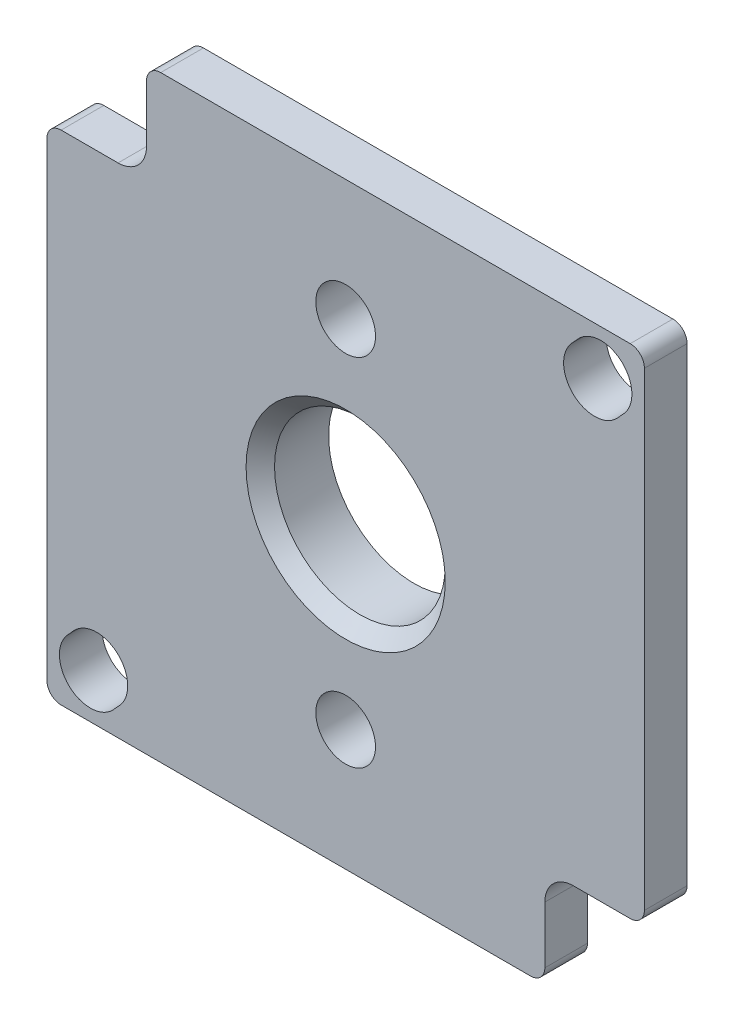
from build123d import *

# Parameters (mm, degrees)
SKETCH1_W                = 42
SKETCH1_H                = 42
BOSS_EXTRUDE1_DEPTH      = 3
SKETCH2_W                = 7
SKETCH2_H                = 7
CUT_EXTRUDE1_DEPTH       = 30.849623113
SKETCH3_W                = 7
SKETCH3_H                = 7
CUT_EXTRUDE2_DEPTH       = 30.849623113
CUT_EXTRUDE3_DEPTH       = 30.849623113
CUT_EXTRUDE4_DEPTH       = 30.849623113
BOSS_EXTRUDE2_DEPTH      = 1.8
CUT_EXTRUDE5_DEPTH       = 1.8
CUT_EXTRUDE6_DEPTH       = 1.8
CUT_EXTRUDE7_DEPTH       = 1.8
CUT_EXTRUDE8_DEPTH       = 1.8
CUT_EXTRUDE9_DEPTH       = 1.8
CUT_EXTRUDE10_DEPTH      = 1.8
F_6_CLEARANCE_HOLE1_D    = 4.2
F_7_16_CLEARANCE_HOLE1_D = 12
CHAMFER1_SIZE            = 1
CHAMFER2_SIZE            = 0.5
FILLET1_R                = 1
FILLET2_R                = 2


with BuildPart() as part:
    # Sketch1 → Boss-Extrude1 (new body)
    with BuildSketch(Plane(origin=(0, 0, -1.5), x_dir=(-1, 0, 0), z_dir=(0, 0, -1))):
        Rectangle(SKETCH1_W, SKETCH1_H)
    extrude(amount=-BOSS_EXTRUDE1_DEPTH)

    # Sketch2 → Cut-Extrude1 (cut, through all)
    with BuildSketch(Plane.XY.offset(1.5)):
        with Locations((17.5, -17.5)):
            Rectangle(SKETCH2_W, SKETCH2_H)
    extrude(amount=-CUT_EXTRUDE1_DEPTH, mode=Mode.SUBTRACT)

    # Sketch3 → Cut-Extrude2 (cut, through all)
    with BuildSketch(Plane.XY.offset(1.5)):
        with Locations((-17.5, 17.5)):
            Rectangle(SKETCH3_W, SKETCH3_H)
    extrude(amount=-CUT_EXTRUDE2_DEPTH, mode=Mode.SUBTRACT)

    # Sketch4 → Cut-Extrude3 (cut, through all)
    with BuildSketch(Plane(origin=(0, 0, -1.5), x_dir=(-1, 0, 0), z_dir=(0, 0, -1))):
        with BuildLine():
            Line((-19.548087821, 16.508696573), (-19.107888427, 16.027894431))
            ThreePointArc((-19.107888427, 16.027894431), (-16.027894431, 15.892111573), (-15.892111573, 18.972105569))
            Line((-15.892111573, 18.972105569), (-16.332310968, 19.452907712))
            ThreePointArc((-16.332310968, 19.452907712), (-19.412304964, 19.588690569), (-19.548087821, 16.508696573))
        make_face()
    extrude(amount=-CUT_EXTRUDE3_DEPTH, mode=Mode.SUBTRACT)

    # Sketch5 → Cut-Extrude4 (cut, through all)
    with BuildSketch(Plane.XY.offset(1.5)):
        with BuildLine():
            Line((-16.332310968, -19.452907712), (-15.892111573, -18.972105569))
            ThreePointArc((-15.892111573, -18.972105569), (-16.027894431, -15.892111573), (-19.107888427, -16.027894431))
            Line((-19.107888427, -16.027894431), (-19.548087821, -16.508696573))
            ThreePointArc((-19.548087821, -16.508696573), (-19.412304964, -19.588690569), (-16.332310968, -19.452907712))
        make_face()
    extrude(amount=-CUT_EXTRUDE4_DEPTH, mode=Mode.SUBTRACT)

    # Sketch6 → Boss-Extrude2 (add)
    with BuildSketch(Plane(origin=(0, 0, -1.5), x_dir=(-1, 0, 0), z_dir=(0, 0, -1))):
        with BuildLine():
            ThreePointArc((5.054164776, -14.01661223), (4.091520809, -13.857772568), (3.722336121, -12.954657895))
            ThreePointArc((3.722336121, -12.954657895), (0, -8.75), (-3.722336121, -12.954657895))
            ThreePointArc((-3.722336121, -12.954657895), (-4.091520809, -13.857772568), (-5.054164776, -14.01661223))
            ThreePointArc((-5.054164776, -14.01661223), (-14.9, 0), (-5.054164776, 14.01661223))
            ThreePointArc((-5.054164776, 14.01661223), (-4.091520809, 13.857772568), (-3.722336121, 12.954657895))
            ThreePointArc((-3.722336121, 12.954657895), (0, 8.75), (3.722336121, 12.954657895))
            ThreePointArc((3.722336121, 12.954657895), (4.091520809, 13.857772568), (5.054164776, 14.01661223))
            ThreePointArc((5.054164776, 14.01661223), (14.9, 0), (5.054164776, -14.01661223))
        make_face()
    extrude(amount=BOSS_EXTRUDE2_DEPTH)

    # Sketch7 → Cut-Extrude5 (cut)
    with BuildSketch(Plane(origin=(0, 0, -3.3), x_dir=(-1, 0, 0), z_dir=(0, 0, -1))):
        with BuildLine():
            Line((12.180022738, -5.586326708), (7.185244801, -3.517421946))
            ThreePointArc((7.185244801, -3.517421946), (5.763132034, -5.548541174), (3.787411898, -7.046666667))
            ThreePointArc((3.787411898, -7.046666667), (3.269080183, -7.799376362), (3.579104244, -8.6591))
            ThreePointArc((3.579104244, -8.6591), (4.779623152, -10.327972715), (5.247243656, -12.3299))
            ThreePointArc((5.247243656, -12.3299), (9.343251505, -9.605396989), (12.180022738, -5.586326708))
        make_face()
    extrude(amount=-CUT_EXTRUDE5_DEPTH, mode=Mode.SUBTRACT)

    # Sketch8 → Cut-Extrude6 (cut)
    with BuildSketch(Plane(origin=(0, 0, -3.3), x_dir=(-1, 0, 0), z_dir=(0, 0, -1))):
        with BuildLine():
            Line((-12.180022738, 5.586326708), (-7.185244801, 3.517421946))
            ThreePointArc((-7.185244801, 3.517421946), (-5.763132034, 5.548541174), (-3.787411898, 7.046666667))
            ThreePointArc((-3.787411898, 7.046666667), (-3.269080183, 7.799376362), (-3.579104244, 8.6591))
            ThreePointArc((-3.579104244, 8.6591), (-4.779623152, 10.327972715), (-5.247243656, 12.3299))
            ThreePointArc((-5.247243656, 12.3299), (-9.343251505, 9.605396989), (-12.180022738, 5.586326708))
        make_face()
    extrude(amount=-CUT_EXTRUDE6_DEPTH, mode=Mode.SUBTRACT)

    # Sketch9 → Cut-Extrude7 (cut)
    with BuildSketch(Plane(origin=(0, 0, -3.3), x_dir=(-1, 0, 0), z_dir=(0, 0, -1))):
        with BuildLine():
            Line((-7.185244801, -3.517421946), (-12.180022738, -5.586326708))
            ThreePointArc((-12.180022738, -5.586326708), (-9.343251505, -9.605396989), (-5.247243656, -12.3299))
            ThreePointArc((-5.247243656, -12.3299), (-4.779623152, -10.327972715), (-3.579104244, -8.6591))
            ThreePointArc((-3.579104244, -8.6591), (-3.269080183, -7.799376362), (-3.787411898, -7.046666667))
            ThreePointArc((-3.787411898, -7.046666667), (-5.763132034, -5.548541174), (-7.185244801, -3.517421946))
        make_face()
    extrude(amount=-CUT_EXTRUDE7_DEPTH, mode=Mode.SUBTRACT)

    # Sketch10 → Cut-Extrude8 (cut)
    with BuildSketch(Plane(origin=(0, 0, -3.3), x_dir=(-1, 0, 0), z_dir=(0, 0, -1))):
        with BuildLine():
            Line((7.185244801, 3.517421946), (12.180022738, 5.586326708))
            ThreePointArc((12.180022738, 5.586326708), (9.343251505, 9.605396989), (5.247243656, 12.3299))
            ThreePointArc((5.247243656, 12.3299), (4.779623152, 10.327972715), (3.579104244, 8.6591))
            ThreePointArc((3.579104244, 8.6591), (3.269080183, 7.799376362), (3.787411898, 7.046666667))
            ThreePointArc((3.787411898, 7.046666667), (5.763132034, 5.548541174), (7.185244801, 3.517421946))
        make_face()
    extrude(amount=-CUT_EXTRUDE8_DEPTH, mode=Mode.SUBTRACT)

    # Sketch11 → Cut-Extrude9 (cut)
    with BuildSketch(Plane(origin=(0, 0, -3.3), x_dir=(-1, 0, 0), z_dir=(0, 0, -1))):
        with BuildLine():
            Line((12.562706171, 4.662447176), (7.567928234, 2.593542413))
            ThreePointArc((7.567928234, 2.593542413), (8, 0), (7.567928234, -2.593542413))
            Line((7.567928234, -2.593542413), (12.562706171, -4.662447176))
            ThreePointArc((12.562706171, -4.662447176), (13.4, 0), (12.562706171, 4.662447176))
        make_face()
    extrude(amount=-CUT_EXTRUDE9_DEPTH, mode=Mode.SUBTRACT)

    # Sketch12 → Cut-Extrude10 (cut)
    with BuildSketch(Plane(origin=(0, 0, -3.3), x_dir=(-1, 0, 0), z_dir=(0, 0, -1))):
        with BuildLine():
            Line((-12.562706171, -4.662447176), (-7.567928234, -2.593542413))
            ThreePointArc((-7.567928234, -2.593542413), (-8, 0), (-7.567928234, 2.593542413))
            Line((-7.567928234, 2.593542413), (-12.562706171, 4.662447176))
            ThreePointArc((-12.562706171, 4.662447176), (-13.4, 0), (-12.562706171, -4.662447176))
        make_face()
    extrude(amount=-CUT_EXTRUDE10_DEPTH, mode=Mode.SUBTRACT)

    # #6 Clearance Hole1 (through all)
    with Locations(Plane(origin=(0, 0, -1.5), x_dir=(-1, 0, 0), z_dir=(0, 0, -1))):
        with Locations((0, -12.5), (0, 12.5)):
            Hole(F_6_CLEARANCE_HOLE1_D / 2)

    # 7/16 Clearance Hole1 (through all)
    with Locations(Plane.XY.offset(1.5)):
        with Locations((0, 0)):
            Hole(F_7_16_CLEARANCE_HOLE1_D / 2)

    # Chamfer1
    chamfer1_edges = [part.edges().sort_by_distance(p)[0] for p in [
        (6, 0, 1.5),
    ]]
    chamfer(chamfer1_edges, length=CHAMFER1_SIZE)

    # Chamfer2
    chamfer2_edges = [part.edges().sort_by_distance(p)[0] for p in [
        (-14.9, 0, -3.3),
        (-4.091520809, 13.857772568, -3.3),
        (0, 8.75, -3.3),
        (4.091520809, 13.857772568, -3.3),
        (14.9, 0, -3.3),
        (4.091520809, -13.857772568, -3.3),
        (0, -8.75, -3.3),
        (-4.091520809, -13.857772568, -3.3),
    ]]
    chamfer(chamfer2_edges, length=CHAMFER2_SIZE)

    # Fillet1
    fillet1_edges = [part.edges().sort_by_distance(p)[0] for p in [
        (-7.185244801, -3.517421946, -2.4),
        (-12.180022738, -5.586326708, -2.4),
        (-5.247243656, -12.3299, -2.4),
        (7.185244801, 3.517421946, -2.4),
        (12.180022738, 5.586326708, -2.4),
        (5.247243656, 12.3299, -2.4),
        (5.247243656, -12.3299, -2.4),
        (12.180022738, -5.586326708, -2.4),
        (7.185244801, -3.517421946, -2.4),
        (-5.247243656, 12.3299, -2.4),
        (-12.180022738, 5.586326708, -2.4),
        (-7.185244801, 3.517421946, -2.4),
        (-12.562706171, 4.662447176, -2.4),
        (-12.562706171, -4.662447176, -2.4),
        (-7.567928234, -2.593542413, -2.4),
        (-7.567928234, 2.593542413, -2.4),
        (12.562706171, -4.662447176, -2.4),
        (12.562706171, 4.662447176, -2.4),
        (7.567928234, 2.593542413, -2.4),
        (7.567928234, -2.593542413, -2.4),
        (21, -14, 0),
        (14, -21, 0),
        (-21, 14, 0),
        (-14, 21, 0),
        (21, 21, 0),
        (-21, -21, 0),
    ]]
    fillet(fillet1_edges, radius=FILLET1_R)

    # Fillet2
    fillet2_edges = [part.edges().sort_by_distance(p)[0] for p in [
        (14, -14, 0),
        (-14, 14, 0),
    ]]
    fillet(fillet2_edges, radius=FILLET2_R)


solid = part.part
